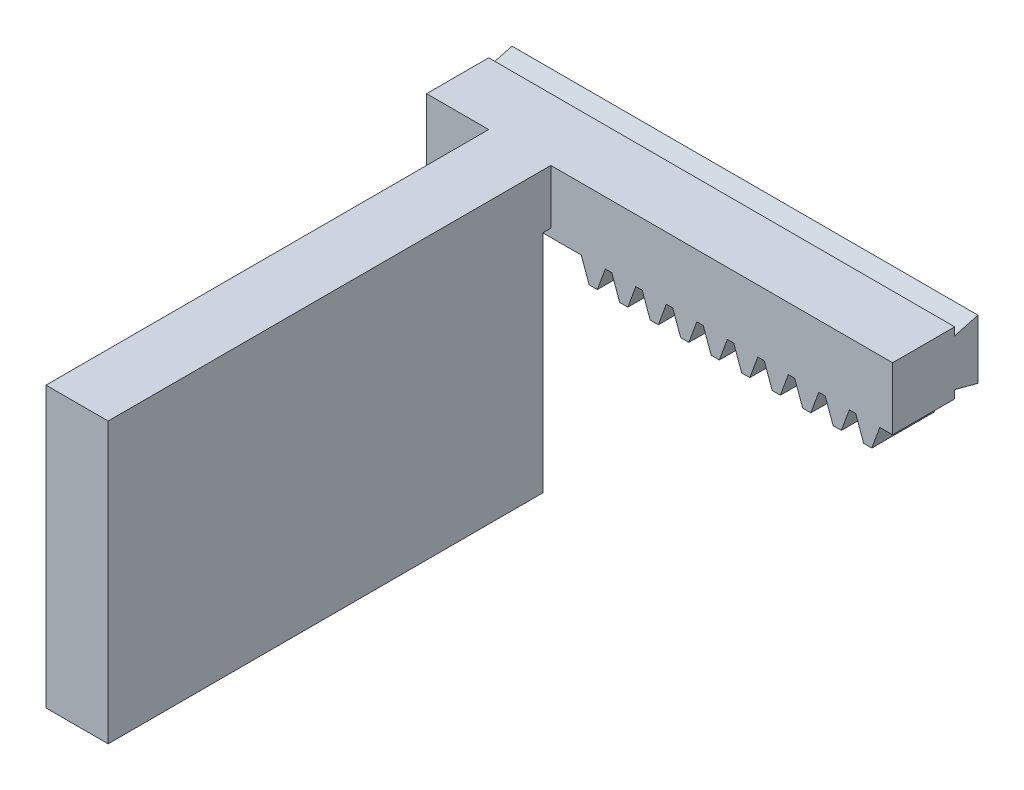
from build123d import *

# Parameters (mm, degrees)
RACK_BODY_8MM_DEPTH             = 8
FINGER_ARM_8MM_DEPTH            = 8
DOVETAIL_TONGUE_52_8_DEPTH      = 52
DOVETAIL_TONGUE_52_8_DEPTH_BACK = 8
SENSOR_POCKET_PLACEHOLDER_R     = 10
SENSOR_POCKET_CUT_DEPTH         = 1.5
NEOPRENED_PAD_SKETCH_W          = 30
NEOPRENED_PAD_SKETCH_H          = 30
NEOPRENE_PAD_NOT_PRINTED_DEPTH  = 1.5


with BuildPart() as part:
    # Rack profile m1.25 → Rack body 8mm (new body)
    with BuildSketch(Plane.XY):
        Polygon((-8, 21), (52, 21), (52, 12.9625), (50.356863957, 12.9625), (49.333197673, 10.15), (48.27962785, 10.15), (47.255961566, 12.9625), (46.42987314, 12.9625), (45.406206856, 10.15), (44.352637033, 10.15), (43.328970749, 12.9625), (42.502882323, 12.9625), (41.479216039, 10.15), (40.425646216, 10.15), (39.401979932, 12.9625), (38.575891506, 12.9625), (37.552225222, 10.15), (36.498655399, 10.15), (35.474989115, 12.9625), (34.648900689, 12.9625), (33.625234405, 10.15), (32.571664582, 10.15), (31.547998298, 12.9625), (30.721909872, 12.9625), (29.698243588, 10.15), (28.644673765, 10.15), (27.621007481, 12.9625), (26.794919055, 12.9625), (25.771252771, 10.15), (24.717682948, 10.15), (23.694016664, 12.9625), (22.867928238, 12.9625), (21.844261954, 10.15), (20.790692131, 10.15), (19.767025847, 12.9625), (18.940937421, 12.9625), (17.917271137, 10.15), (16.863701314, 10.15), (15.84003503, 12.9625), (15.013946604, 12.9625), (13.99028032, 10.15), (12.936710497, 10.15), (11.913044213, 12.9625), (-8, 12.9625), align=None)
    extrude(amount=RACK_BODY_8MM_DEPTH)

    # Finger Arm Profile → Finger arm 8mm (add)
    with BuildSketch(Plane(origin=(0, 0, 0), x_dir=(0, 0, -1), z_dir=(1, 0, 0))):
        Polygon((-2, 21), (-65, 21), (-65, -15), (-9, -15), (-9, 14), (-2, 14), align=None)
    extrude(amount=FINGER_ARM_8MM_DEPTH)

    # Dovetail Tongue → Dovetail Tongue 52 + 8 (add, two sides: drawn at the far end of the back side and taken through both)
    with BuildSketch(Plane(origin=(0, 0, 0), x_dir=(0, 0, -1), z_dir=(1, 0, 0)).offset(-DOVETAIL_TONGUE_52_8_DEPTH_BACK)):
        Polygon((0, 14), (0, 20), (3, 20.8), (3, 13.2), align=None)
    extrude(amount=DOVETAIL_TONGUE_52_8_DEPTH + DOVETAIL_TONGUE_52_8_DEPTH_BACK)

    # Sensor Pocket Placeholder → Sensor Pocket Cut (cut)
    with BuildSketch(Plane(origin=(0, 0, 0), x_dir=(0, 0, -1), z_dir=(1, 0, 0))):
        with Locations((-48, 0)):
            Circle(SENSOR_POCKET_PLACEHOLDER_R)
    extrude(amount=SENSOR_POCKET_CUT_DEPTH, mode=Mode.SUBTRACT)


with BuildPart() as body_2:
    # Neoprened pad sketch → Neoprene pad (not printed) (new body)
    with BuildSketch(Plane(origin=(0, 0, 0), x_dir=(0, 0, -1), z_dir=(1, 0, 0))):
        with Locations((-48, 0)):
            Rectangle(NEOPRENED_PAD_SKETCH_W, NEOPRENED_PAD_SKETCH_H)
    extrude(amount=-NEOPRENE_PAD_NOT_PRINTED_DEPTH)


solid = Compound([part.part, body_2.part])
